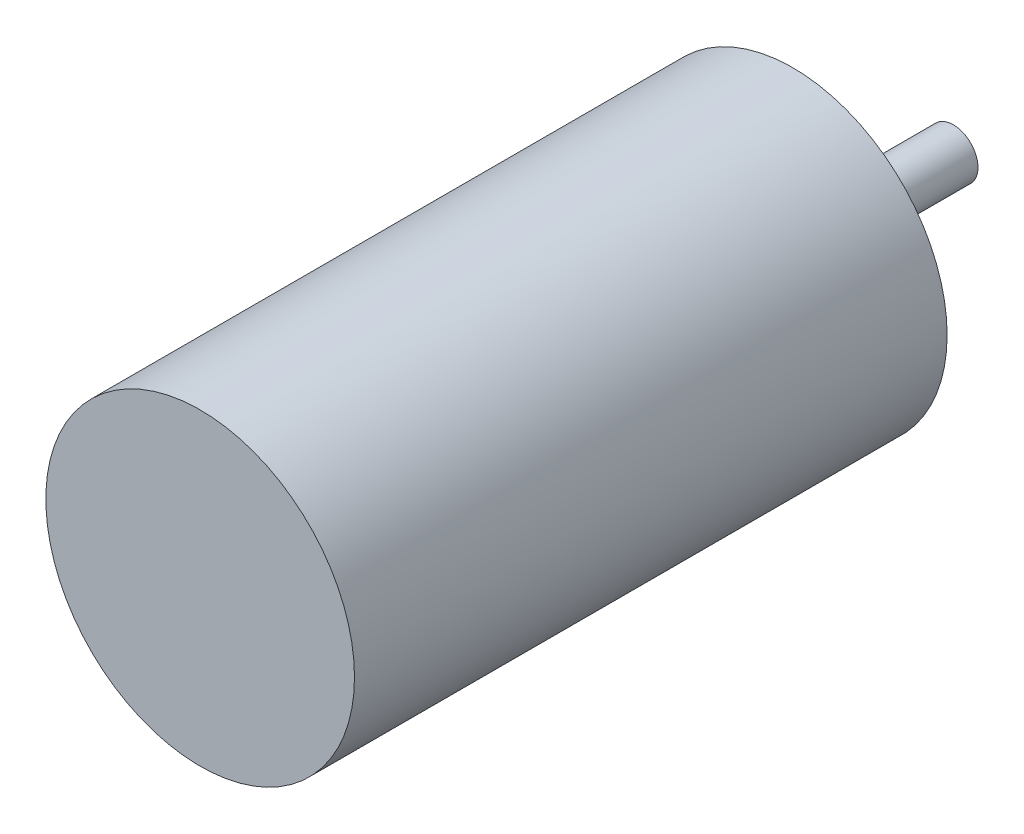
from build123d import *

# Parameters (mm, degrees)
TAP_DRILL_FOR_M3X0_5_TAP1_D     = 2.5
TAP_DRILL_FOR_M3X0_5_TAP1_DEPTH = 5
TAP_DRILL_FOR_M3X0_5_TAP1_TIP   = 0.751075774


with BuildPart() as part:
    # Sketch1 → Revolve1 (revolve)
    with BuildSketch(Plane(origin=(0, 0, 0), x_dir=(0, 0, -1), z_dir=(1, 0, 0)), mode=Mode.PRIVATE) as revolve1_sk:
        Polygon((0, 0), (0, -2), (-10, -2), (-10, -3.5), (-13, -3.5), (-13, -12.5), (-61, -12.5), (-61, 0), align=None)
    revolve(revolve1_sk.sketch.rotate(Axis((0, 0, 61), (0, 0, -1)), 270), axis=Axis((0, 0, 61), (0, 0, -1)))

    # Tap Drill for M3x0.5 Tap1
    with Locations(Plane(origin=(0, 0, 13), x_dir=(-1, 0, 0), z_dir=(0, 0, -1))):
        with Locations((-8.5, 0), (8.5, 0)):
            Hole(TAP_DRILL_FOR_M3X0_5_TAP1_D / 2, depth=TAP_DRILL_FOR_M3X0_5_TAP1_DEPTH)
            with Locations((0, 0, -(TAP_DRILL_FOR_M3X0_5_TAP1_DEPTH + TAP_DRILL_FOR_M3X0_5_TAP1_TIP / 2))):  # 118° drill point
                Cone(0, TAP_DRILL_FOR_M3X0_5_TAP1_D / 2, TAP_DRILL_FOR_M3X0_5_TAP1_TIP, mode=Mode.SUBTRACT)


solid = part.part
